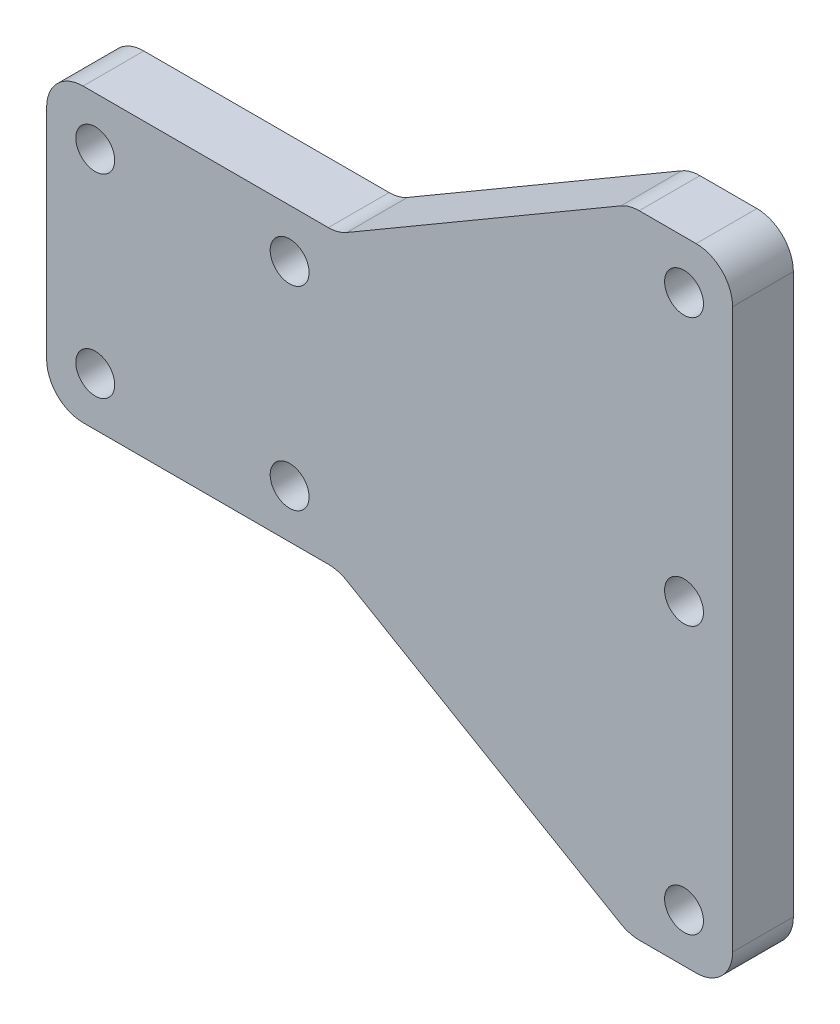
from build123d import *

# Parameters (mm, degrees)
SKETCH_1_R      = 1.6
EXTRUDE_1_DEPTH = 5
FILLET_1_R      = 3


with BuildPart() as part:
    # 草图1 → 凸台-拉伸1 (new body)
    with BuildSketch(Plane.XY):
        Polygon((44.464500341, -26), (44.464500341, 26), (35.964500341, 26), (12, 12), (-12, 12), (-12, -12), (12, -12), (35.964500341, -26), align=None)
        with Locations((40.464500341, -22)):
            Circle(SKETCH_1_R, mode=Mode.SUBTRACT)
        with Locations((40.464500341, 0)):
            Circle(SKETCH_1_R, mode=Mode.SUBTRACT)
        with Locations((40.464500341, 22)):
            Circle(SKETCH_1_R, mode=Mode.SUBTRACT)
        with Locations((-8, -8)):
            Circle(SKETCH_1_R, mode=Mode.SUBTRACT)
        with Locations((8, -8)):
            Circle(SKETCH_1_R, mode=Mode.SUBTRACT)
        with Locations((8, 8)):
            Circle(SKETCH_1_R, mode=Mode.SUBTRACT)
        with Locations((-8, 8)):
            Circle(SKETCH_1_R, mode=Mode.SUBTRACT)
    extrude(amount=EXTRUDE_1_DEPTH)

    # 圆角1
    fillet_1_edges = [part.edges().sort_by_distance(p)[0] for p in [
        (44.464500341, 26, 2.5),
        (44.464500341, -26, 2.5),
        (35.964500341, -26, 2.5),
        (35.964500341, 26, 2.5),
        (12, 12, 2.5),
        (-12, 12, 2.5),
        (12, -12, 2.5),
        (-12, -12, 2.5),
    ]]
    fillet(fillet_1_edges, radius=FILLET_1_R)


solid = part.part
